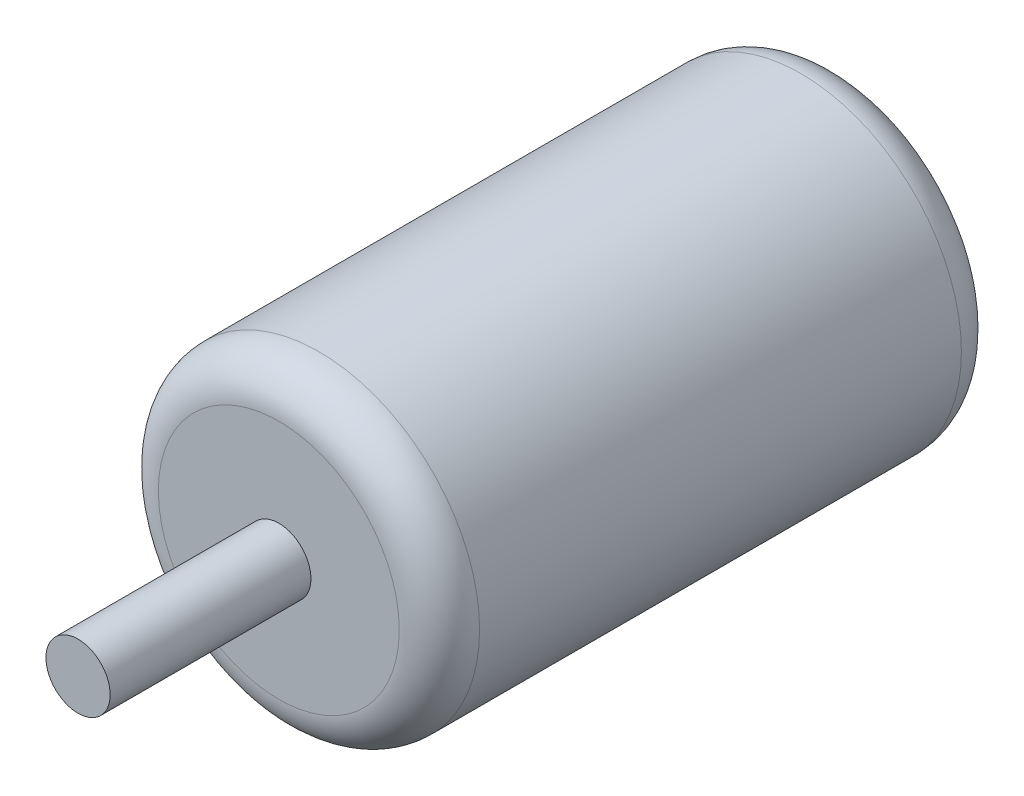
from build123d import *

# Parameters (mm, degrees)
SKETCH1_R           = 20
BOSS_EXTRUDE1_DEPTH = 70
SKETCH2_R           = 4
BOSS_EXTRUDE2_DEPTH = 25
FILLET1_R           = 5


with BuildPart() as part:
    # Sketch1 → Boss-Extrude1 (new body)
    with BuildSketch(Plane.XY):
        Circle(SKETCH1_R)
    extrude(amount=BOSS_EXTRUDE1_DEPTH)

    # Sketch2 → Boss-Extrude2 (add)
    with BuildSketch(Plane.XY.offset(70)):
        Circle(SKETCH2_R)
    extrude(amount=BOSS_EXTRUDE2_DEPTH)

    # Fillet1
    fillet1_edges = [part.edges().sort_by_distance(p)[0] for p in [
        (-20, 0, 0),
        (-20, 0, 70),
    ]]
    fillet(fillet1_edges, radius=FILLET1_R)


solid = part.part
